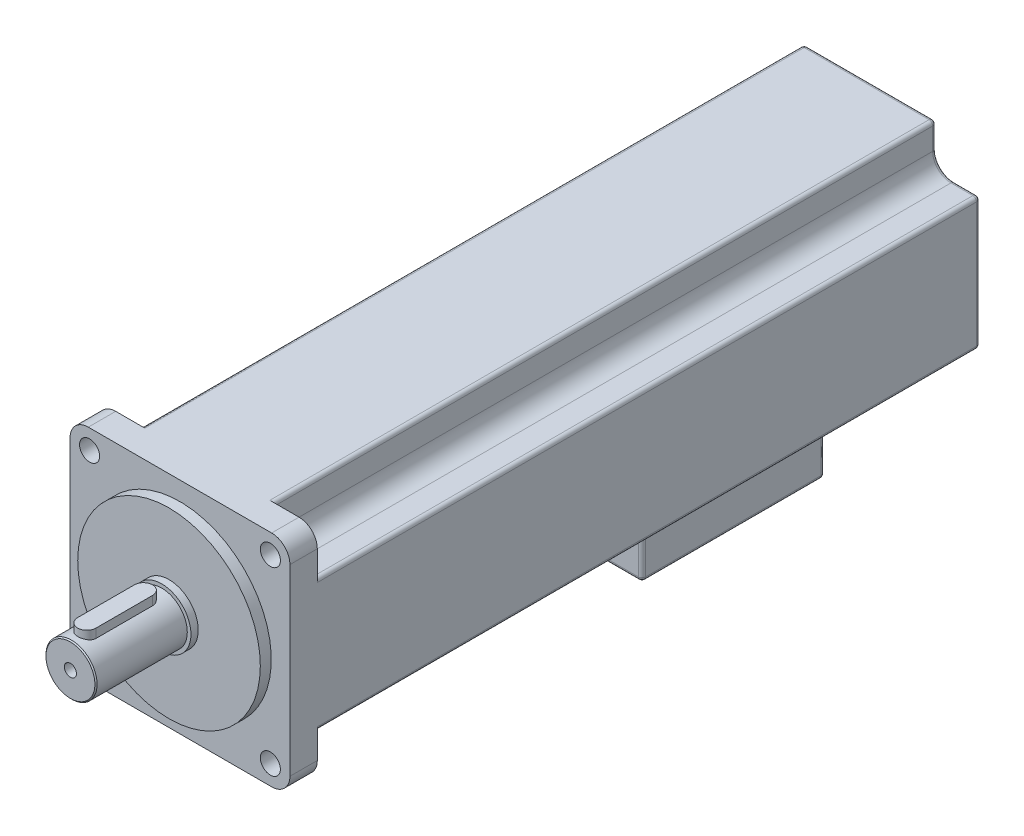
from build123d import *

# Parameters (mm, degrees)
SKETCH_1_W             = 60.2
SKETCH_1_H             = 60.2
EXTRUDE_1_DEPTH        = 7.5
FILLET_1_R             = 5
SKETCH_2_R             = 2.75
CUT_EXTRUDE_1_DEPTH    = 44.223488985
SKETCH_3_R             = 25
EXTRUDE_2_DEPTH        = 3
SKETCH_4_R             = 8
EXTRUDE_3_DEPTH        = 2
SKETCH_5_R             = 7
EXTRUDE_4_DEPTH        = 25
HOLE_WIZARD_M4_2_D     = 3.3
HOLE_WIZARD_M4_2_DEPTH = 10.1
HOLE_WIZARD_M4_2_TIP   = 0.991420021
CHAMFER_1_SIZE         = 0.3
EXTRUDE_5_DEPTH        = 5
EXTRUDE_6_DEPTH        = 181.5
FILLET_2_R             = 5
SKETCH_13_W            = 15
SKETCH_13_H            = 50
EXTRUDE_7_DEPTH        = 20
FILLET_3_R             = 1


with BuildPart() as part:
    # 草图1 → 凸台-拉伸1 (new body)
    with BuildSketch(Plane.XY):
        Rectangle(SKETCH_1_W, SKETCH_1_H)
    extrude(amount=EXTRUDE_1_DEPTH)

    # 圆角1
    fillet_1_edges = [part.edges().sort_by_distance(p)[0] for p in [
        (30.1, -30.1, 3.75),
        (-30.1, -30.1, 3.75),
        (-30.1, 30.1, 3.75),
        (30.1, 30.1, 3.75),
    ]]
    fillet(fillet_1_edges, radius=FILLET_1_R)

    # 草图2 → 切除-拉伸1 (cut, through all)
    with BuildSketch(Plane.XY.offset(7.5)):
        with Locations((-24.748737342, 24.748737342)):
            Circle(SKETCH_2_R)
        with Locations((24.748737342, 24.748737342)):
            Circle(SKETCH_2_R)
        with Locations((24.748737342, -24.748737342)):
            Circle(SKETCH_2_R)
        with Locations((-24.748737342, -24.748737342)):
            Circle(SKETCH_2_R)
    extrude(amount=-CUT_EXTRUDE_1_DEPTH, mode=Mode.SUBTRACT)

    # 草图3 → 凸台-拉伸2 (add)
    with BuildSketch(Plane.XY.offset(7.5)):
        with Locations(Location((0, 0, 0), (0, 0, 180))):
            Circle(SKETCH_3_R)
    extrude(amount=EXTRUDE_2_DEPTH)

    # 草图4 → 凸台-拉伸3 (add)
    with BuildSketch(Plane.XY.offset(10.5)):
        Circle(SKETCH_4_R)
    extrude(amount=EXTRUDE_3_DEPTH)

    # 草图5 → 凸台-拉伸4 (add)
    with BuildSketch(Plane.XY.offset(12.5)):
        Circle(SKETCH_5_R)
    extrude(amount=EXTRUDE_4_DEPTH)

    # M4 螺纹孔2
    with Locations(Plane.XY.offset(37.5)):
        with Locations((0, 0)):
            Hole(HOLE_WIZARD_M4_2_D / 2, depth=HOLE_WIZARD_M4_2_DEPTH)
            with Locations((0, 0, -(HOLE_WIZARD_M4_2_DEPTH + HOLE_WIZARD_M4_2_TIP / 2))):  # 118° drill point
                Cone(0, HOLE_WIZARD_M4_2_D / 2, HOLE_WIZARD_M4_2_TIP, mode=Mode.SUBTRACT)

    # 倒角1
    chamfer_1_edges = [part.edges().sort_by_distance(p)[0] for p in [
        (-7, 0, 37.5),
    ]]
    chamfer(chamfer_1_edges, length=CHAMFER_1_SIZE)

    # 草图10 → 凸台-拉伸5 (add)
    with BuildSketch(Plane(origin=(0, 9, 0), x_dir=(1, 0, 0), z_dir=(0, 1, 0))):
        with BuildLine():
            Line((-2.5, -33), (-2.5, -17.5))
            ThreePointArc((-2.5, -17.5), (0, -15), (2.5, -17.5))
            Line((2.5, -17.5), (2.5, -33))
            ThreePointArc((2.5, -33), (0, -35.5), (-2.5, -33))
        make_face()
    extrude(amount=-EXTRUDE_5_DEPTH)

    # 草图12 → 凸台-拉伸6 (add)
    with BuildSketch(Plane(origin=(0, 0, 0), x_dir=(-1, 0, 0), z_dir=(0, 0, -1))):
        Polygon((30.1, -18.1), (18.1, -18.1), (18.1, -30.1), (-18.1, -30.1), (-18.1, -18.1), (-30.1, -18.1), (-30.1, 18.1), (-18.1, 18.1), (-18.1, 30.1), (18.1, 30.1), (18.1, 18.1), (30.1, 18.1), align=None)
    extrude(amount=EXTRUDE_6_DEPTH)

    # 圆角2
    fillet_2_edges = [part.edges().sort_by_distance(p)[0] for p in [
        (-18.1, 18.1, -90.75),
        (18.1, 18.1, -90.75),
        (18.1, -18.1, -90.75),
        (-18.1, -18.1, -90.75),
    ]]
    fillet(fillet_2_edges, radius=FILLET_2_R)

    # 草图13 → 凸台-拉伸7 (add)
    with BuildSketch(Plane.XZ.offset(30.1)):
        with Locations((0, -136.5)):
            Rectangle(SKETCH_13_W, SKETCH_13_H)
    extrude(amount=EXTRUDE_7_DEPTH)

    # 圆角3
    fillet_3_edges = [part.edges().sort_by_distance(p)[0] for p in [
        (-30.1, -18.1, -90.75),
        (-30.1, 18.1, -90.75),
        (-18.1, 30.1, -90.75),
        (18.1, 30.1, -90.75),
        (30.1, 18.1, -90.75),
        (30.1, -18.1, -90.75),
        (18.1, -30.1, -90.75),
        (-18.1, -30.1, -90.75),
        (-30.1, 0, -181.5),
        (-26.6, 18.1, -181.5),
        (0, 30.1, -181.5),
        (18.1, 26.6, -181.5),
        (30.1, 0, -181.5),
        (26.6, -18.1, -181.5),
        (0, -30.1, -181.5),
        (-18.1, -26.6, -181.5),
        (-26.6, -18.1, -181.5),
        (-18.1, 26.6, -181.5),
        (26.6, 18.1, -181.5),
        (18.1, -26.6, -181.5),
        (-19.564466094, -19.564466094, -181.5),
        (-19.564466094, 19.564466094, -181.5),
        (19.564466094, 19.564466094, -181.5),
        (19.564466094, -19.564466094, -181.5),
        (-7.5, -40.1, -111.5),
        (-7.5, -40.1, -161.5),
        (7.5, -40.1, -161.5),
        (7.5, -40.1, -111.5),
        (-7.5, -50.1, -136.5),
        (0, -50.1, -161.5),
        (7.5, -50.1, -136.5),
        (0, -50.1, -111.5),
    ]]
    fillet(fillet_3_edges, radius=FILLET_3_R)


solid = part.part
